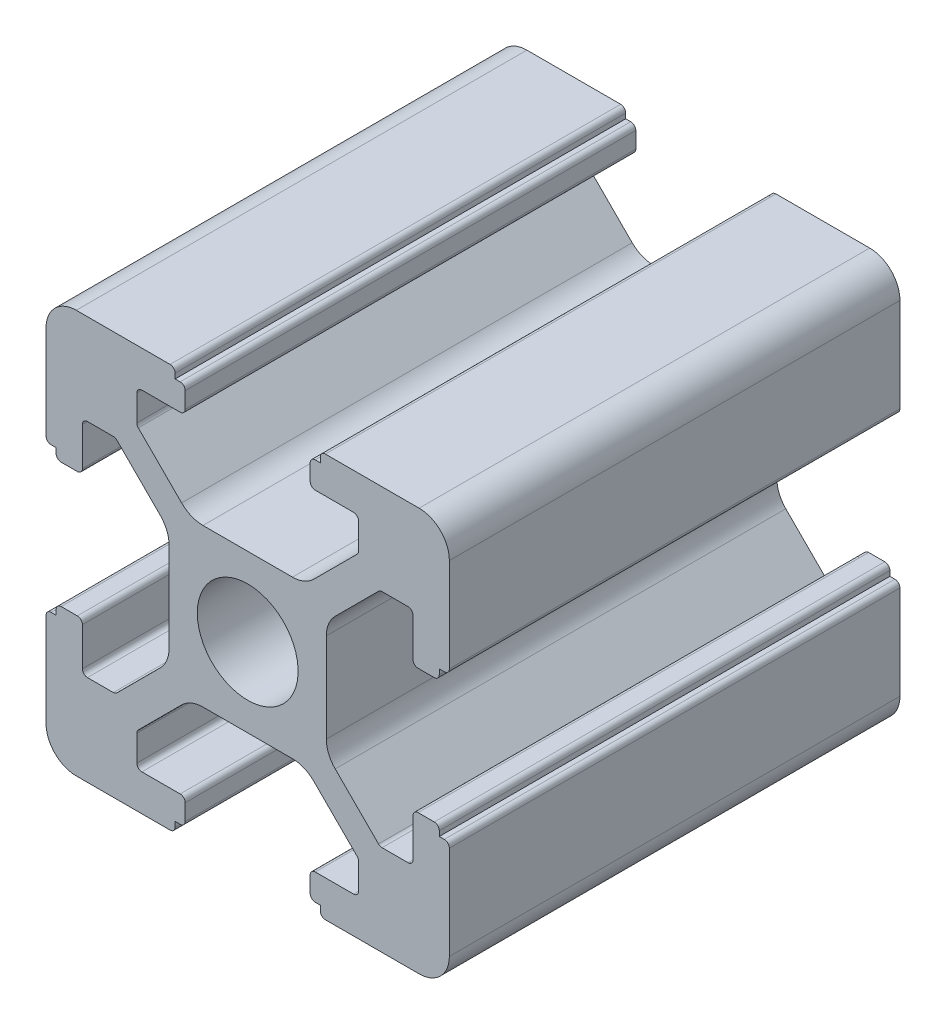
from build123d import *

# Parameters (mm, degrees)
SKETCH_1_R      = 2.5
EXTRUDE_1_DEPTH = 22.35


with BuildPart() as part:
    # 草图1 → 凸台-拉伸1 (new body)
    with BuildSketch(Plane.XY):
        with BuildLine():
            Line((-8.502261885, -10.002261885), (-3.85, -10.002261885))
            ThreePointArc((-3.85, -10.002261885), (-3.673223305, -9.929038581), (-3.6, -9.752261885))
            Line((-3.6, -9.752261885), (-3.6, -9.502261885))
            Line((-3.6, -9.502261885), (-3.35, -9.502261885))
            ThreePointArc((-3.35, -9.502261885), (-3.173223305, -9.429038581), (-3.1, -9.252261885))
            Line((-3.1, -9.252261885), (-3.1, -8.45))
            ThreePointArc((-3.1, -8.45), (-3.173223305, -8.273223305), (-3.35, -8.2))
            Line((-3.35, -8.2), (-5.25, -8.2))
            ThreePointArc((-5.25, -8.2), (-5.426776695, -8.126776695), (-5.5, -7.95))
            Line((-5.5, -7.95), (-5.5, -6.664213562))
            ThreePointArc((-5.5, -6.664213562), (-5.480969883, -6.568542704), (-5.426776695, -6.487436867))
            Line((-5.426776695, -6.487436867), (-3.278679656, -4.339339828))
            ThreePointArc((-3.278679656, -4.339339828), (-2.792044633, -4.014180701), (-2.218019485, -3.9))
            Line((-2.218019485, -3.9), (2.218019485, -3.9))
            ThreePointArc((2.218019485, -3.9), (2.792044633, -4.014180701), (3.278679656, -4.339339828))
            Line((3.278679656, -4.339339828), (5.426776695, -6.487436867))
            ThreePointArc((5.426776695, -6.487436867), (5.480969883, -6.568542704), (5.5, -6.664213562))
            Line((5.5, -6.664213562), (5.5, -7.95))
            ThreePointArc((5.5, -7.95), (5.426776695, -8.126776695), (5.25, -8.2))
            Line((5.25, -8.2), (3.35, -8.2))
            ThreePointArc((3.35, -8.2), (3.173223305, -8.273223305), (3.1, -8.45))
            Line((3.1, -8.45), (3.1, -9.252261885))
            ThreePointArc((3.1, -9.252261885), (3.173223305, -9.429038581), (3.35, -9.502261885))
            Line((3.35, -9.502261885), (3.6, -9.502261885))
            Line((3.6, -9.502261885), (3.6, -9.752261885))
            ThreePointArc((3.6, -9.752261885), (3.673223305, -9.929038581), (3.85, -10.002261885))
            Line((3.85, -10.002261885), (8.502261885, -10.002261885))
            ThreePointArc((8.502261885, -10.002261885), (9.562922057, -9.562922057), (10.002261885, -8.502261885))
            Line((10.002261885, -8.502261885), (10.002261885, -3.85))
            ThreePointArc((10.002261885, -3.85), (9.929038581, -3.673223305), (9.752261885, -3.6))
            Line((9.752261885, -3.6), (9.502261885, -3.6))
            Line((9.502261885, -3.6), (9.502261885, -3.35))
            ThreePointArc((9.502261885, -3.35), (9.429038581, -3.173223305), (9.252261885, -3.1))
            Line((9.252261885, -3.1), (8.45, -3.1))
            ThreePointArc((8.45, -3.1), (8.273223305, -3.173223305), (8.2, -3.35))
            Line((8.2, -3.35), (8.2, -5.25))
            ThreePointArc((8.2, -5.25), (8.126776695, -5.426776695), (7.95, -5.5))
            Line((7.95, -5.5), (6.664213562, -5.5))
            ThreePointArc((6.664213562, -5.5), (6.568542704, -5.480969883), (6.487436867, -5.426776695))
            Line((6.487436867, -5.426776695), (4.339339828, -3.278679656))
            ThreePointArc((4.339339828, -3.278679656), (4.014180701, -2.792044633), (3.9, -2.218019485))
            Line((3.9, -2.218019485), (3.9, 2.218019485))
            ThreePointArc((3.9, 2.218019485), (4.014180701, 2.792044633), (4.339339828, 3.278679656))
            Line((4.339339828, 3.278679656), (6.487436867, 5.426776695))
            ThreePointArc((6.487436867, 5.426776695), (6.568542704, 5.480969883), (6.664213562, 5.5))
            Line((6.664213562, 5.5), (7.95, 5.5))
            ThreePointArc((7.95, 5.5), (8.126776695, 5.426776695), (8.2, 5.25))
            Line((8.2, 5.25), (8.2, 3.35))
            ThreePointArc((8.2, 3.35), (8.273223305, 3.173223305), (8.45, 3.1))
            Line((8.45, 3.1), (9.252261885, 3.1))
            ThreePointArc((9.252261885, 3.1), (9.429038581, 3.173223305), (9.502261885, 3.35))
            Line((9.502261885, 3.35), (9.502261885, 3.6))
            Line((9.502261885, 3.6), (9.752261885, 3.6))
            ThreePointArc((9.752261885, 3.6), (9.929038581, 3.673223305), (10.002261885, 3.85))
            Line((10.002261885, 3.85), (10.002261885, 8.502261885))
            ThreePointArc((10.002261885, 8.502261885), (9.562922057, 9.562922057), (8.502261885, 10.002261885))
            Line((8.502261885, 10.002261885), (3.85, 10.002261885))
            ThreePointArc((3.85, 10.002261885), (3.673223305, 9.929038581), (3.6, 9.752261885))
            Line((3.6, 9.752261885), (3.6, 9.502261885))
            Line((3.6, 9.502261885), (3.35, 9.502261885))
            ThreePointArc((3.35, 9.502261885), (3.173223305, 9.429038581), (3.1, 9.252261885))
            Line((3.1, 9.252261885), (3.1, 8.45))
            ThreePointArc((3.1, 8.45), (3.173223305, 8.273223305), (3.35, 8.2))
            Line((3.35, 8.2), (5.25, 8.2))
            ThreePointArc((5.25, 8.2), (5.426776695, 8.126776695), (5.5, 7.95))
            Line((5.5, 7.95), (5.5, 6.664213562))
            ThreePointArc((5.5, 6.664213562), (5.480969883, 6.568542704), (5.426776695, 6.487436867))
            Line((5.426776695, 6.487436867), (3.278679656, 4.339339828))
            ThreePointArc((3.278679656, 4.339339828), (2.792044633, 4.014180701), (2.218019485, 3.9))
            Line((2.218019485, 3.9), (-2.218019485, 3.9))
            ThreePointArc((-2.218019485, 3.9), (-2.792044633, 4.014180701), (-3.278679656, 4.339339828))
            Line((-3.278679656, 4.339339828), (-5.426776695, 6.487436867))
            ThreePointArc((-5.426776695, 6.487436867), (-5.480969883, 6.568542704), (-5.5, 6.664213562))
            Line((-5.5, 6.664213562), (-5.5, 7.95))
            ThreePointArc((-5.5, 7.95), (-5.426776695, 8.126776695), (-5.25, 8.2))
            Line((-5.25, 8.2), (-3.35, 8.2))
            ThreePointArc((-3.35, 8.2), (-3.173223305, 8.273223305), (-3.1, 8.45))
            Line((-3.1, 8.45), (-3.1, 9.252261885))
            ThreePointArc((-3.1, 9.252261885), (-3.173223305, 9.429038581), (-3.35, 9.502261885))
            Line((-3.35, 9.502261885), (-3.6, 9.502261885))
            Line((-3.6, 9.502261885), (-3.6, 9.752261885))
            ThreePointArc((-3.6, 9.752261885), (-3.673223305, 9.929038581), (-3.85, 10.002261885))
            Line((-3.85, 10.002261885), (-8.502261885, 10.002261885))
            ThreePointArc((-8.502261885, 10.002261885), (-9.562922057, 9.562922057), (-10.002261885, 8.502261885))
            Line((-10.002261885, 8.502261885), (-10.002261885, 3.85))
            ThreePointArc((-10.002261885, 3.85), (-9.929038581, 3.673223305), (-9.752261885, 3.6))
            Line((-9.752261885, 3.6), (-9.502261885, 3.6))
            Line((-9.502261885, 3.6), (-9.502261885, 3.35))
            ThreePointArc((-9.502261885, 3.35), (-9.429038581, 3.173223305), (-9.252261885, 3.1))
            Line((-9.252261885, 3.1), (-8.45, 3.1))
            ThreePointArc((-8.45, 3.1), (-8.273223305, 3.173223305), (-8.2, 3.35))
            Line((-8.2, 3.35), (-8.2, 5.25))
            ThreePointArc((-8.2, 5.25), (-8.126776695, 5.426776695), (-7.95, 5.5))
            Line((-7.95, 5.5), (-6.664213562, 5.5))
            ThreePointArc((-6.664213562, 5.5), (-6.568542704, 5.480969883), (-6.487436867, 5.426776695))
            Line((-6.487436867, 5.426776695), (-4.339339828, 3.278679656))
            ThreePointArc((-4.339339828, 3.278679656), (-4.014180701, 2.792044633), (-3.9, 2.218019485))
            Line((-3.9, 2.218019485), (-3.9, -2.218019485))
            ThreePointArc((-3.9, -2.218019485), (-4.014180701, -2.792044633), (-4.339339828, -3.278679656))
            Line((-4.339339828, -3.278679656), (-6.487436867, -5.426776695))
            ThreePointArc((-6.487436867, -5.426776695), (-6.568542704, -5.480969883), (-6.664213562, -5.5))
            Line((-6.664213562, -5.5), (-7.95, -5.5))
            ThreePointArc((-7.95, -5.5), (-8.126776695, -5.426776695), (-8.2, -5.25))
            Line((-8.2, -5.25), (-8.2, -3.35))
            ThreePointArc((-8.2, -3.35), (-8.273223305, -3.173223305), (-8.45, -3.1))
            Line((-8.45, -3.1), (-9.252261885, -3.1))
            ThreePointArc((-9.252261885, -3.1), (-9.429038581, -3.173223305), (-9.502261885, -3.35))
            Line((-9.502261885, -3.35), (-9.502261885, -3.6))
            Line((-9.502261885, -3.6), (-9.752261885, -3.6))
            ThreePointArc((-9.752261885, -3.6), (-9.929038581, -3.673223305), (-10.002261885, -3.85))
            Line((-10.002261885, -3.85), (-10.002261885, -8.502261885))
            ThreePointArc((-10.002261885, -8.502261885), (-9.562922057, -9.562922057), (-8.502261885, -10.002261885))
        make_face()
        with Locations(Location((0, 0, 0), (0, 0, 180))):
            Circle(SKETCH_1_R, mode=Mode.SUBTRACT)
    extrude(amount=EXTRUDE_1_DEPTH)


solid = part.part
